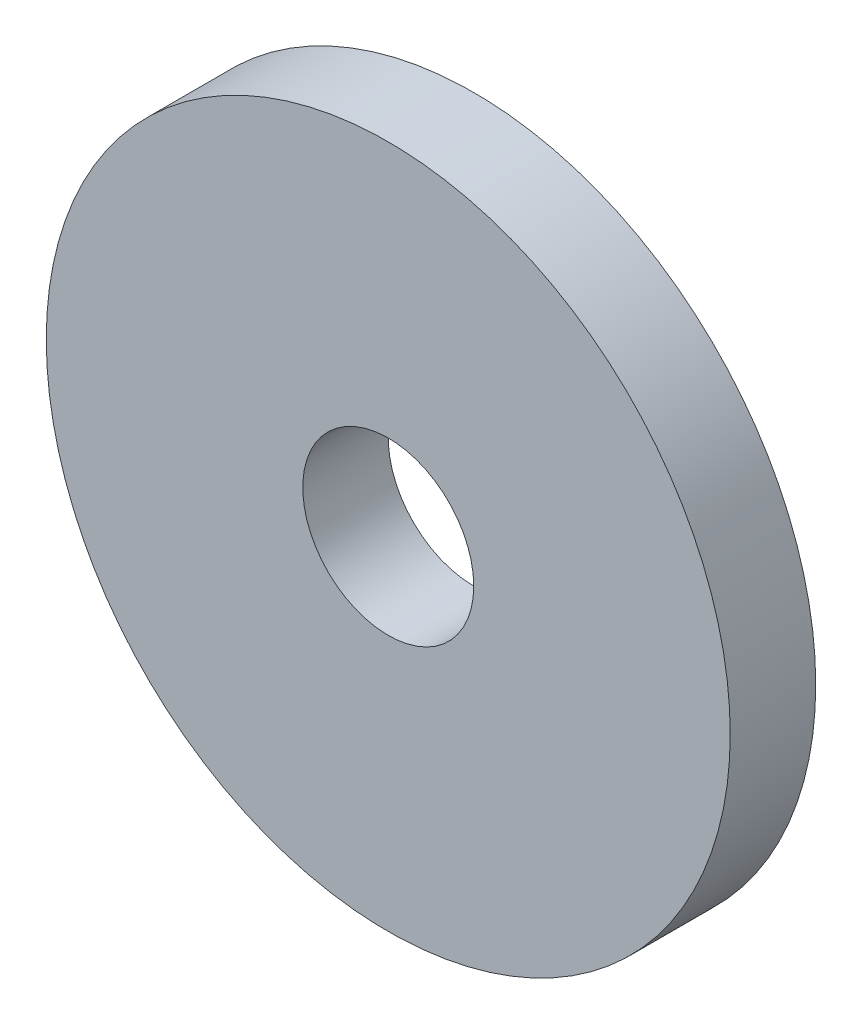
from build123d import *

# Parameters (mm, degrees)
SKETCH1_R           = 4
SKETCH1_R_2         = 1
BOSS_EXTRUDE1_DEPTH = 1


with BuildPart() as part:
    # Sketch1 → Boss-Extrude1 (new body)
    with BuildSketch(Plane.XY):
        Circle(SKETCH1_R)
        Circle(SKETCH1_R_2, mode=Mode.SUBTRACT)
    extrude(amount=BOSS_EXTRUDE1_DEPTH)


solid = part.part
